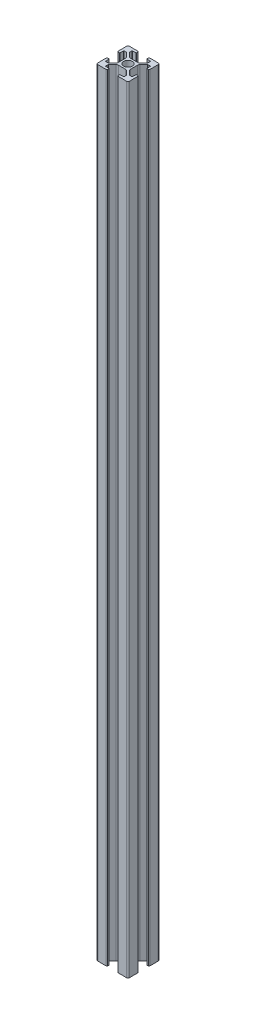
from build123d import *
from build123d.topology import SkipClean

# Parameters (mm, degrees)
SKETCH1_W           = 19.6
SKETCH1_H           = 19.6
BOSS_EXTRUDE1_DEPTH = 480
CUT_EXTRUDE3_DEPTH  = 481.799667221
SKETCH6_R           = 2
CUT_EXTRUDE5_DEPTH  = 10


with BuildPart() as part:
    # Sketch1 → Boss-Extrude1 (new body)
    with BuildSketch(Plane(origin=(0, 0, 0), x_dir=(1, 0, 0), z_dir=(0, 1, 0))):
        with Locations((9.8, 9.8)):
            Rectangle(SKETCH1_W, SKETCH1_H)
    extrude(amount=BOSS_EXTRUDE1_DEPTH)

    # Sketch4 → Cut-Extrude3 (cut, through all)
    with BuildSketch(Plane.XZ):
        with BuildLine():
            Line((6.05, -19.6), (13.55, -19.6))
            ThreePointArc((13.55, -19.6), (13.196446609, -19.453553391), (13.05, -19.1))
            Line((13.05, -19.1), (13.05, -18.3))
            ThreePointArc((13.05, -18.3), (13.108578644, -18.158578644), (13.25, -18.1))
            Line((13.25, -18.1), (15.3, -18.1))
            ThreePointArc((15.3, -18.1), (15.441421356, -18.041421356), (15.5, -17.9))
            Line((15.5, -17.9), (15.5, -16.43137085))
            ThreePointArc((15.5, -16.43137085), (15.484775907, -16.354834163), (15.441421356, -16.289949494))
            Line((15.441421356, -16.289949494), (13.090811691, -13.939339828))
            ThreePointArc((13.090811691, -13.939339828), (12.604176668, -13.614180701), (12.030151519, -13.5))
            Line((12.030151519, -13.5), (9.8, -13.5))
            Line((9.8, -13.5), (7.569848481, -13.5))
            ThreePointArc((7.569848481, -13.5), (6.995823332, -13.614180701), (6.509188309, -13.939339828))
            Line((6.509188309, -13.939339828), (4.158578644, -16.289949494))
            ThreePointArc((4.158578644, -16.289949494), (4.115224093, -16.354834163), (4.1, -16.43137085))
            Line((4.1, -16.43137085), (4.1, -17.9))
            ThreePointArc((4.1, -17.9), (4.158578644, -18.041421356), (4.3, -18.1))
            Line((4.3, -18.1), (6.35, -18.1))
            ThreePointArc((6.35, -18.1), (6.491421356, -18.158578644), (6.55, -18.3))
            Line((6.55, -18.3), (6.55, -19.1))
            ThreePointArc((6.55, -19.1), (6.403553391, -19.453553391), (6.05, -19.6))
        make_face()
        with BuildLine():
            Line((0, -6.05), (0, -13.55))
            ThreePointArc((0, -13.55), (0.146446609, -13.196446609), (0.5, -13.05))
            Line((0.5, -13.05), (1.3, -13.05))
            ThreePointArc((1.3, -13.05), (1.441421356, -13.108578644), (1.5, -13.25))
            Line((1.5, -13.25), (1.5, -15.3))
            ThreePointArc((1.5, -15.3), (1.558578644, -15.441421356), (1.7, -15.5))
            Line((1.7, -15.5), (3.16862915, -15.5))
            ThreePointArc((3.16862915, -15.5), (3.245165837, -15.484775907), (3.310050506, -15.441421356))
            Line((3.310050506, -15.441421356), (5.660660172, -13.090811691))
            ThreePointArc((5.660660172, -13.090811691), (5.985819299, -12.604176668), (6.1, -12.030151519))
            Line((6.1, -12.030151519), (6.1, -7.569848481))
            ThreePointArc((6.1, -7.569848481), (5.985819299, -6.995823332), (5.660660172, -6.509188309))
            Line((5.660660172, -6.509188309), (3.310050506, -4.158578644))
            ThreePointArc((3.310050506, -4.158578644), (3.245165837, -4.115224093), (3.16862915, -4.1))
            Line((3.16862915, -4.1), (1.7, -4.1))
            ThreePointArc((1.7, -4.1), (1.558578644, -4.158578644), (1.5, -4.3))
            Line((1.5, -4.3), (1.5, -6.35))
            ThreePointArc((1.5, -6.35), (1.441421356, -6.491421356), (1.3, -6.55))
            Line((1.3, -6.55), (0.5, -6.55))
            ThreePointArc((0.5, -6.55), (0.146446609, -6.403553391), (0, -6.05))
        make_face()
        with BuildLine():
            ThreePointArc((19.1, -13.05), (19.453553391, -13.196446609), (19.6, -13.55))
            Line((19.6, -13.55), (19.6, -6.05))
            ThreePointArc((19.6, -6.05), (19.453553391, -6.403553391), (19.1, -6.55))
            Line((19.1, -6.55), (18.3, -6.55))
            ThreePointArc((18.3, -6.55), (18.158578644, -6.491421356), (18.1, -6.35))
            Line((18.1, -6.35), (18.1, -4.3))
            ThreePointArc((18.1, -4.3), (18.041421356, -4.158578644), (17.9, -4.1))
            Line((17.9, -4.1), (16.43137085, -4.1))
            ThreePointArc((16.43137085, -4.1), (16.354834163, -4.115224093), (16.289949494, -4.158578644))
            Line((16.289949494, -4.158578644), (13.939339828, -6.509188309))
            ThreePointArc((13.939339828, -6.509188309), (13.614180701, -6.995823332), (13.5, -7.569848481))
            Line((13.5, -7.569848481), (13.5, -12.030151519))
            ThreePointArc((13.5, -12.030151519), (13.614180701, -12.604176668), (13.939339828, -13.090811691))
            Line((13.939339828, -13.090811691), (16.289949494, -15.441421356))
            ThreePointArc((16.289949494, -15.441421356), (16.354834163, -15.484775907), (16.43137085, -15.5))
            Line((16.43137085, -15.5), (17.9, -15.5))
            ThreePointArc((17.9, -15.5), (18.041421356, -15.441421356), (18.1, -15.3))
            Line((18.1, -15.3), (18.1, -13.25))
            ThreePointArc((18.1, -13.25), (18.158578644, -13.108578644), (18.3, -13.05))
            Line((18.3, -13.05), (19.1, -13.05))
        make_face()
        with BuildLine():
            ThreePointArc((13.05, -0.5), (13.196446609, -0.146446609), (13.55, 0))
            Line((13.55, 0), (6.05, 0))
            ThreePointArc((6.05, 0), (6.403553391, -0.146446609), (6.55, -0.5))
            Line((6.55, -0.5), (6.55, -1.3))
            ThreePointArc((6.55, -1.3), (6.491421356, -1.441421356), (6.35, -1.5))
            Line((6.35, -1.5), (4.3, -1.5))
            ThreePointArc((4.3, -1.5), (4.158578644, -1.558578644), (4.1, -1.7))
            Line((4.1, -1.7), (4.1, -3.16862915))
            ThreePointArc((4.1, -3.16862915), (4.115224093, -3.245165837), (4.158578644, -3.310050506))
            Line((4.158578644, -3.310050506), (6.509188309, -5.660660172))
            ThreePointArc((6.509188309, -5.660660172), (6.995823332, -5.985819299), (7.569848481, -6.1))
            Line((7.569848481, -6.1), (9.8, -6.1))
            Line((9.8, -6.1), (12.030151519, -6.1))
            ThreePointArc((12.030151519, -6.1), (12.604176668, -5.985819299), (13.090811691, -5.660660172))
            Line((13.090811691, -5.660660172), (15.441421356, -3.310050506))
            ThreePointArc((15.441421356, -3.310050506), (15.484775907, -3.245165837), (15.5, -3.16862915))
            Line((15.5, -3.16862915), (15.5, -1.7))
            ThreePointArc((15.5, -1.7), (15.441421356, -1.558578644), (15.3, -1.5))
            Line((15.3, -1.5), (13.25, -1.5))
            ThreePointArc((13.25, -1.5), (13.108578644, -1.441421356), (13.05, -1.3))
            Line((13.05, -1.3), (13.05, -0.5))
        make_face()
        with BuildLine():
            ThreePointArc((18.6, 0), (19.307106781, -0.292893219), (19.6, -1))
            Line((19.6, -1), (19.6, 0))
            Line((19.6, 0), (18.6, 0))
        make_face()
        with BuildLine():
            ThreePointArc((0, -1), (0.292893219, -0.292893219), (1, 0))
            Line((1, 0), (0, 0))
            Line((0, 0), (0, -1))
        make_face()
        with BuildLine():
            ThreePointArc((9.8, -7.15), (12.45, -9.8), (9.8, -12.45))
            ThreePointArc((9.8, -12.45), (7.15, -9.8), (9.8, -7.15))
        make_face()
        with BuildLine():
            Line((19.6, -19.6), (18.6, -19.6))
            ThreePointArc((18.6, -19.6), (19.307106781, -19.307106781), (19.6, -18.6))
            Line((19.6, -18.6), (19.6, -19.6))
        make_face()
        with BuildLine():
            Line((0, -19.6), (0, -18.6))
            ThreePointArc((0, -18.6), (0.292893219, -19.307106781), (1, -19.6))
            Line((1, -19.6), (0, -19.6))
        make_face()
    extrude(amount=-CUT_EXTRUDE3_DEPTH, mode=Mode.SUBTRACT)

    # Sketch6 → Cut-Extrude5 (cut)
    with SkipClean():  # the faces are left unmerged after this step: merging them gives an invalid solid
        with BuildSketch(Plane(origin=(0, 0, -13.5), x_dir=(-1, 0, 0), z_dir=(0, 0, -1))):
            with Locations((-9.8, 10)):
                Circle(SKETCH6_R)
            with Locations((-9.8, 470)):
                Circle(SKETCH6_R)
        extrude(amount=-CUT_EXTRUDE5_DEPTH, mode=Mode.SUBTRACT)


solid = part.part
